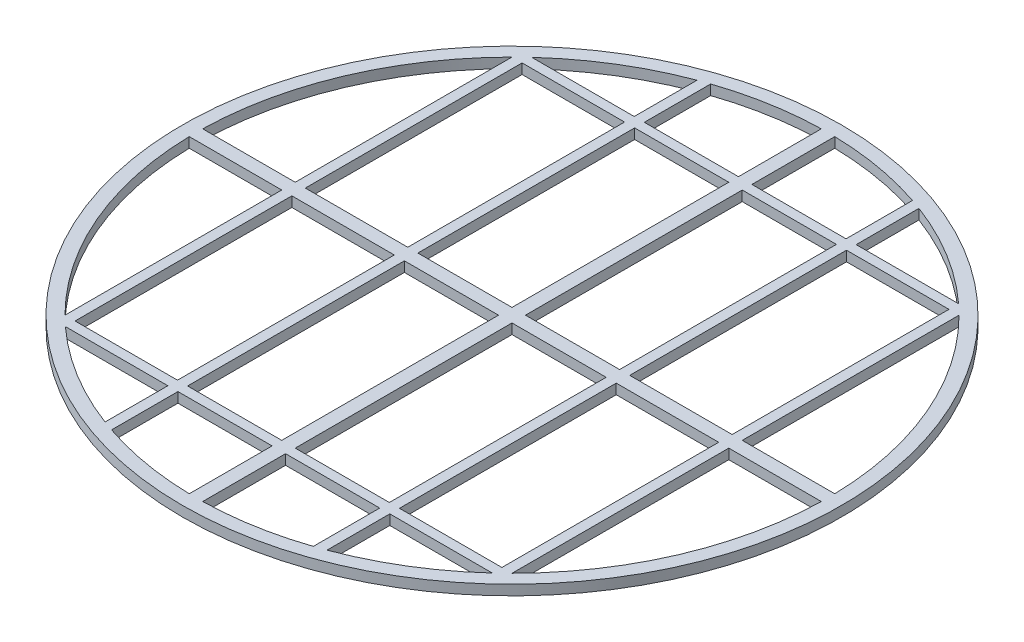
from build123d import *

# Parameters (mm, degrees)
SKETCH_1_R      = 98
EXTRUDE_1_DEPTH = 3
EXTRUDE_2_DEPTH = 3


with BuildPart() as part:
    # 草图1 → 凸台-拉伸1 (new body)
    with BuildSketch(Plane(origin=(0, 0, 0), x_dir=(1, 0, 0), z_dir=(0, 1, 0))):
        with Locations(Location((0, 0, 0), (0, 0, 270))):
            Circle(SKETCH_1_R)
        with BuildLine():
            ThreePointArc((-66.468037432, -66.468037432), (-86.457056016, -36.894138626), (-93.978720996, -2))
            Line((-93.978720996, -2), (-66.468037432, -2))
            Line((-66.468037432, -2), (-66.468037432, -66.468037432))
        make_face(mode=Mode.SUBTRACT)
        with BuildLine():
            Line((-63.468037432, -2), (-33, -2))
            Line((-33, -2), (-33, -88.017043804))
            ThreePointArc((-33, -88.017043804), (-49.129867339, -80.138980123), (-63.468037432, -69.338360412))
            Line((-63.468037432, -69.338360412), (-63.468037432, -2))
        make_face(mode=Mode.SUBTRACT)
        with BuildLine():
            Line((-30, -2), (-2, -2))
            Line((-2, -2), (-2, -93.978720996))
            ThreePointArc((-2, -93.978720996), (-16.186074601, -92.595955576), (-30, -89.084229805))
            Line((-30, -89.084229805), (-30, -2))
        make_face(mode=Mode.SUBTRACT)
        with BuildLine():
            Line((2, -93.978720996), (2, -2))
            Line((2, -2), (30, -2))
            Line((30, -2), (30, -89.084229805))
            ThreePointArc((30, -89.084229805), (16.186074601, -92.595955576), (2, -93.978720996))
        make_face(mode=Mode.SUBTRACT)
        with BuildLine():
            Line((33, -2), (63.468037432, -2))
            Line((63.468037432, -2), (63.468037432, -69.338360412))
            ThreePointArc((63.468037432, -69.338360412), (49.129867339, -80.138980123), (33, -88.017043804))
            Line((33, -88.017043804), (33, -2))
        make_face(mode=Mode.SUBTRACT)
        with BuildLine():
            ThreePointArc((93.978720996, -2), (86.457056016, -36.894138626), (66.468037432, -66.468037432))
            Line((66.468037432, -66.468037432), (66.468037432, -2))
            Line((66.468037432, -2), (93.978720996, -2))
        make_face(mode=Mode.SUBTRACT)
        with BuildLine():
            Line((-66.468037432, 2), (-93.978720996, 2))
            ThreePointArc((-93.978720996, 2), (-86.457056016, 36.894138626), (-66.468037432, 66.468037432))
            Line((-66.468037432, 66.468037432), (-66.468037432, 2))
        make_face(mode=Mode.SUBTRACT)
        with BuildLine():
            Line((-33, 2), (-63.468037432, 2))
            Line((-63.468037432, 2), (-63.468037432, 69.338360412))
            ThreePointArc((-63.468037432, 69.338360412), (-49.129867339, 80.138980123), (-33, 88.017043804))
            Line((-33, 88.017043804), (-33, 2))
        make_face(mode=Mode.SUBTRACT)
        with BuildLine():
            Line((-2, 2), (-30, 2))
            Line((-30, 2), (-30, 89.084229805))
            ThreePointArc((-30, 89.084229805), (-16.186074601, 92.595955576), (-2, 93.978720996))
            Line((-2, 93.978720996), (-2, 2))
        make_face(mode=Mode.SUBTRACT)
        with BuildLine():
            Line((30, 2), (2, 2))
            Line((2, 2), (2, 93.978720996))
            ThreePointArc((2, 93.978720996), (16.186074601, 92.595955576), (30, 89.084229805))
            Line((30, 89.084229805), (30, 2))
        make_face(mode=Mode.SUBTRACT)
        with BuildLine():
            Line((63.468037432, 2), (33, 2))
            Line((33, 2), (33, 88.017043804))
            ThreePointArc((33, 88.017043804), (49.129867339, 80.138980123), (63.468037432, 69.338360412))
            Line((63.468037432, 69.338360412), (63.468037432, 2))
        make_face(mode=Mode.SUBTRACT)
        with BuildLine():
            Line((93.978720996, 2), (66.468037432, 2))
            Line((66.468037432, 2), (66.468037432, 66.468037432))
            ThreePointArc((66.468037432, 66.468037432), (86.457056016, 36.894138626), (93.978720996, 2))
        make_face(mode=Mode.SUBTRACT)
    extrude(amount=EXTRUDE_1_DEPTH)

    # 草图2 → 凸台-拉伸2 (add)
    with BuildSketch(Plane(origin=(0, 3, 0), x_dir=(1, 0, 0), z_dir=(0, 1, 0))):
        Polygon((-66.468037432, 66.468037432), (66.468037432, 66.468037432), (63.468037432, 69.338360412), (-63.468037432, 69.338360412), align=None)
        Polygon((-66.468037432, -66.468037432), (66.468037432, -66.468037432), (63.468037432, -69.338360412), (-63.468037432, -69.338360412), align=None)
    extrude(amount=-EXTRUDE_2_DEPTH)


solid = part.part
